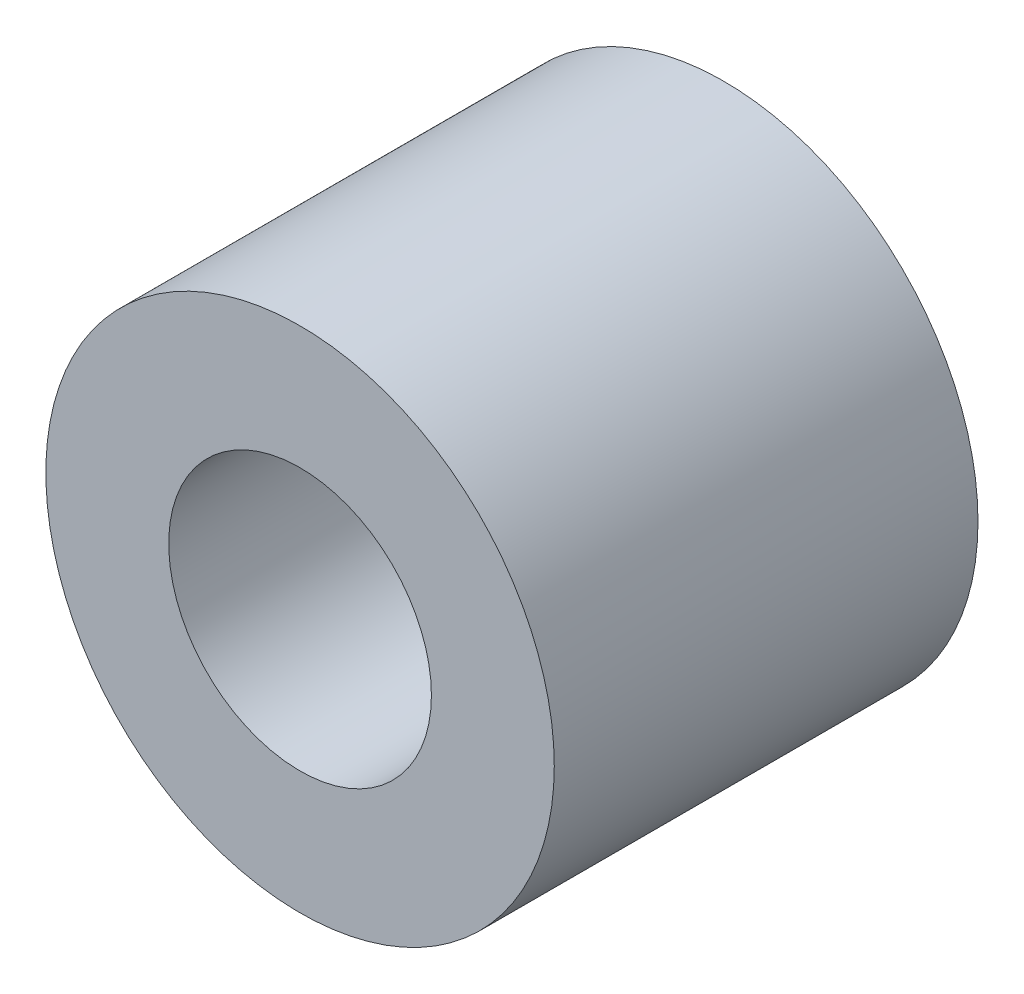
from build123d import *

# Parameters (mm, degrees)
ESQUISSE1_R        = 3
ESQUISSE1_R_2      = 1.55
BOSS_EXTRU_1_DEPTH = 5


with BuildPart() as part:
    # Esquisse1 → Boss.-Extru.1 (new body)
    with BuildSketch(Plane.XY):
        with Locations((0, 0.407753572)):
            Circle(ESQUISSE1_R)
        with Locations((0, 0.407753572)):
            Circle(ESQUISSE1_R_2, mode=Mode.SUBTRACT)
    extrude(amount=BOSS_EXTRU_1_DEPTH)


solid = part.part
